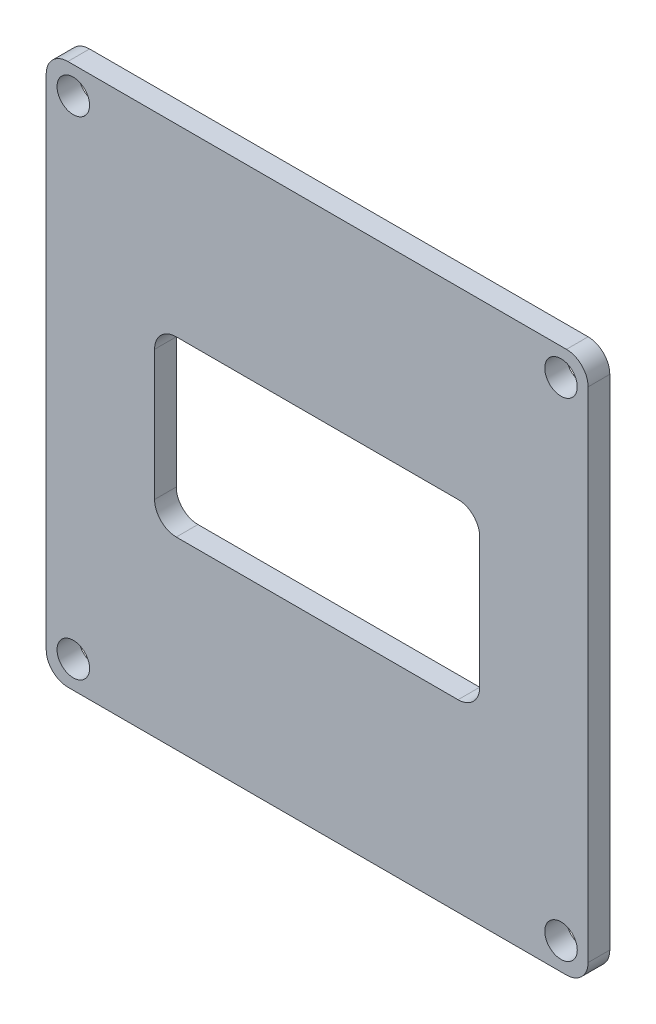
from build123d import *

# Parameters (mm, degrees)
SKETCH_1_W      = 50
SKETCH_1_H      = 50
SKETCH_1_R      = 1.5
SKETCH_1_W_2    = 30
SKETCH_1_H_2    = 16
EXTRUDE_1_DEPTH = 2
FILLET_1_R      = 2
FILLET_2_R      = 2
FILLET_3_R      = 2
FILLET_4_R      = 2
FILLET_5_R      = 2
FILLET_6_R      = 2
FILLET_7_R      = 2
FILLET_8_R      = 2


with BuildPart() as part:
    # 草图1 → 凸台-拉伸1 (new body)
    with BuildSketch(Plane.XY):
        with Locations((4.468911917, 0.842132209)):
            Rectangle(SKETCH_1_W, SKETCH_1_H)
        with Locations((-18.031088083, 23.342132209)):
            Circle(SKETCH_1_R, mode=Mode.SUBTRACT)
        with Locations(Location((26.968911917, 23.342132209, 0), (0, 0, 180))):
            Circle(SKETCH_1_R, mode=Mode.SUBTRACT)
        with Locations((26.968911917, -21.657867791)):
            Circle(SKETCH_1_R, mode=Mode.SUBTRACT)
        with Locations(Location((-18.031088083, -21.657867791, 0), (0, 0, 180))):
            Circle(SKETCH_1_R, mode=Mode.SUBTRACT)
        with Locations((4.468911917, 0.842132209)):
            Rectangle(SKETCH_1_W_2, SKETCH_1_H_2, mode=Mode.SUBTRACT)
    extrude(amount=EXTRUDE_1_DEPTH)

    # 圆角1
    fillet_1_edges = [part.edges().sort_by_distance(p)[0] for p in [
        (19.468911917, 8.842132209, 1),
    ]]
    fillet(fillet_1_edges, radius=FILLET_1_R)

    # 圆角2
    fillet_2_edges = [part.edges().sort_by_distance(p)[0] for p in [
        (19.468911917, -7.157867791, 1),
    ]]
    fillet(fillet_2_edges, radius=FILLET_2_R)

    # 圆角3
    fillet_3_edges = [part.edges().sort_by_distance(p)[0] for p in [
        (-10.531088083, 8.842132209, 1),
    ]]
    fillet(fillet_3_edges, radius=FILLET_3_R)

    # 圆角4
    fillet_4_edges = [part.edges().sort_by_distance(p)[0] for p in [
        (-10.531088083, -7.157867791, 1),
    ]]
    fillet(fillet_4_edges, radius=FILLET_4_R)

    # 圆角5
    fillet_5_edges = [part.edges().sort_by_distance(p)[0] for p in [
        (29.468911917, 25.842132209, 1),
    ]]
    fillet(fillet_5_edges, radius=FILLET_5_R)

    # 圆角6
    fillet_6_edges = [part.edges().sort_by_distance(p)[0] for p in [
        (29.468911917, -24.157867791, 1),
    ]]
    fillet(fillet_6_edges, radius=FILLET_6_R)

    # 圆角7
    fillet_7_edges = [part.edges().sort_by_distance(p)[0] for p in [
        (-20.531088083, 25.842132209, 1),
    ]]
    fillet(fillet_7_edges, radius=FILLET_7_R)

    # 圆角8
    fillet_8_edges = [part.edges().sort_by_distance(p)[0] for p in [
        (-20.531088083, -24.157867791, 1),
    ]]
    fillet(fillet_8_edges, radius=FILLET_8_R)


solid = part.part
